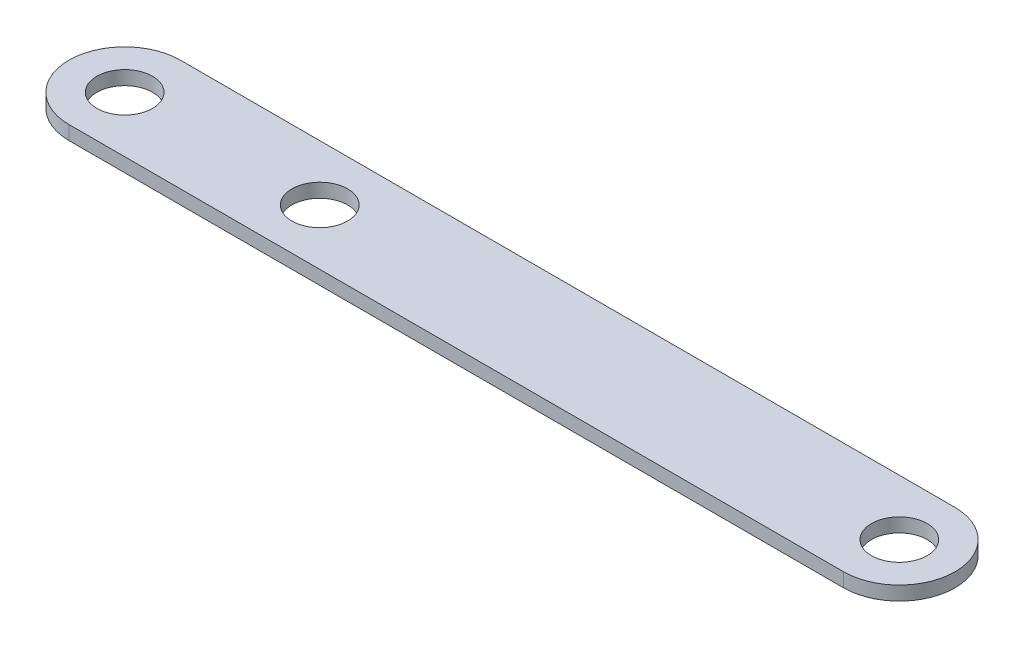
from build123d import *

# Parameters (mm, degrees)
SKETCH1_R           = 6.35
BOSS_EXTRUDE1_DEPTH = 3.175


with BuildPart() as part:
    # Sketch1 → Boss-Extrude1 (new body)
    with BuildSketch(Plane(origin=(0, 0, 0), x_dir=(1, 0, 0), z_dir=(0, 1, 0))):
        with BuildLine():
            Line((0, 12.7), (176.54778, 12.7))
            ThreePointArc((176.54778, 12.7), (189.24778, 0), (176.54778, -12.7))
            Line((176.54778, -12.7), (0, -12.7))
            ThreePointArc((0, -12.7), (-12.7, 0), (0, 12.7))
        make_face()
        with Locations(Location((0, 0, 0), (0, 0, 270))):
            Circle(SKETCH1_R, mode=Mode.SUBTRACT)
        with Locations(Location((44.45, 0, 0), (0, 0, 270))):
            Circle(SKETCH1_R, mode=Mode.SUBTRACT)
        with Locations(Location((176.54778, 0, 0), (0, 0, 270))):
            Circle(SKETCH1_R, mode=Mode.SUBTRACT)
    extrude(amount=BOSS_EXTRUDE1_DEPTH)


solid = part.part
